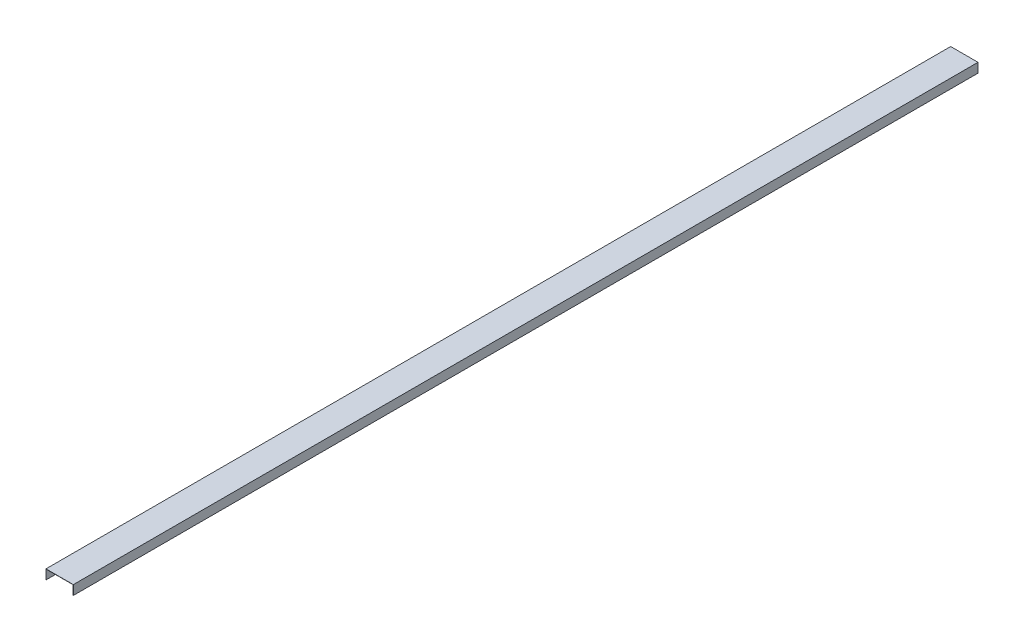
from build123d import *

# Parameters (mm, degrees)
SKETCH1_W           = 92.075
SKETCH1_H           = 3048
BOSS_EXTRUDE1_DEPTH = 31.75
SKETCH2_W           = 90.551
SKETCH2_H           = 3048
CUT_EXTRUDE1_DEPTH  = 30.988


with BuildPart() as part:
    # Sketch1 → Boss-Extrude1 (new body)
    with BuildSketch(Plane(origin=(0, 0, 0), x_dir=(1, 0, 0), z_dir=(0, 1, 0))):
        Rectangle(SKETCH1_W, SKETCH1_H)
    extrude(amount=BOSS_EXTRUDE1_DEPTH)

    # Sketch2 → Cut-Extrude1 (cut)
    with BuildSketch(Plane(origin=(0, 0, 0), x_dir=(1, 0, 0), z_dir=(0, 1, 0))):
        Rectangle(SKETCH2_W, SKETCH2_H)
    extrude(amount=CUT_EXTRUDE1_DEPTH, mode=Mode.SUBTRACT)


solid = part.part
